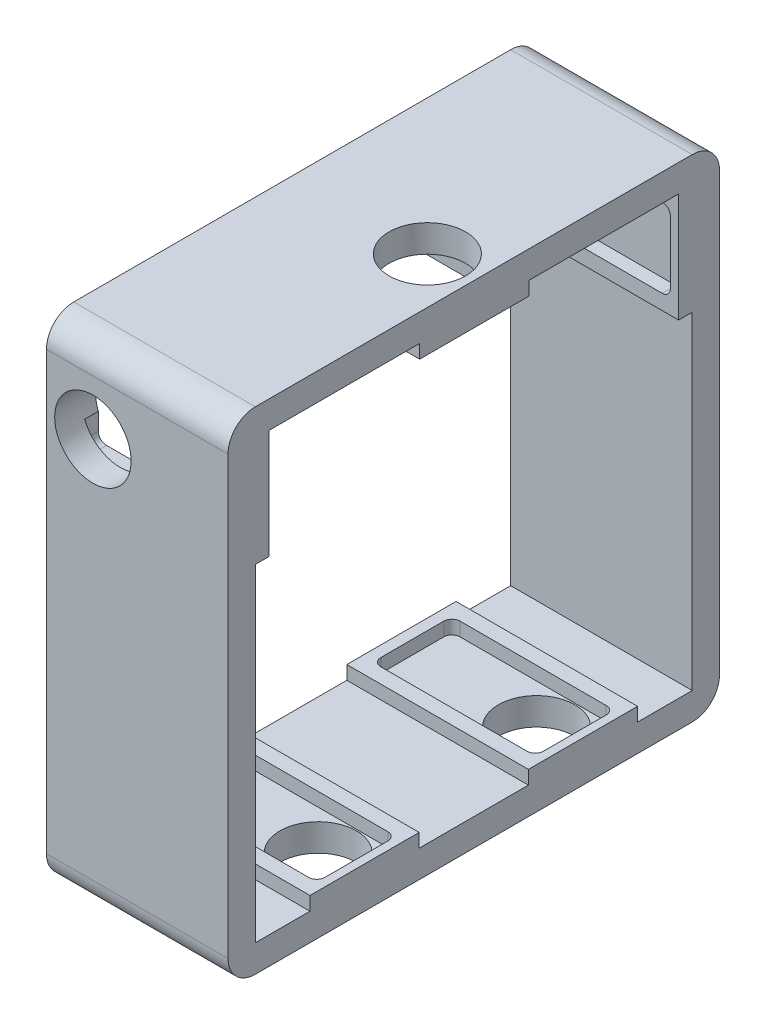
from build123d import *

# Parameters (mm, degrees)
SKETCH1_W           = 66.5
SKETCH1_H           = 180
BOSS_EXTRUDE1_DEPTH = 180
SKETCH3_W           = 160
SKETCH3_H           = 160
CUT_EXTRUDE1_DEPTH  = 180
SKETCH8_W           = 66.5
SKETCH8_H           = 40
BOSS_EXTRUDE2_DEPTH = 5
SKETCH10_W          = 66.5
SKETCH10_H          = 40
BOSS_EXTRUDE3_DEPTH = 5
SKETCH5_R           = 14
CUT_EXTRUDE3_DEPTH  = 10
SKETCH7_R           = 14
CUT_EXTRUDE4_DEPTH  = 10
CUT_EXTRUDE5_DEPTH  = 5
CUT_EXTRUDE6_START  = -5
CUT_EXTRUDE6_DEPTH  = 5
SKETCH12_W          = 66.5
SKETCH12_H          = 40
BOSS_EXTRUDE8_DEPTH = 5
SKETCH15_R          = 14
CUT_EXTRUDE7_DEPTH  = 200
SKETCH16_W          = 66.5
SKETCH16_H          = 40
BOSS_EXTRUDE9_DEPTH = 5
FILLET1_R           = 10
FILLET2_R           = 10


with BuildPart() as part:
    # Sketch1 → Boss-Extrude1 (new body)
    with BuildSketch(Plane.XY):
        with Locations((33.25, 90)):
            Rectangle(SKETCH1_W, SKETCH1_H)
    extrude(amount=BOSS_EXTRUDE1_DEPTH)

    # Sketch3 → Cut-Extrude1 (cut)
    with BuildSketch(Plane.ZY):
        with Locations((90, 90)):
            Rectangle(SKETCH3_W, SKETCH3_H)
    extrude(amount=-CUT_EXTRUDE1_DEPTH, mode=Mode.SUBTRACT)

    # Sketch8 → Boss-Extrude2 (add)
    with BuildSketch(Plane.XY.offset(10)):
        with Locations((33.25, 150)):
            Rectangle(SKETCH8_W, SKETCH8_H)
    extrude(amount=BOSS_EXTRUDE2_DEPTH)

    # Sketch10 → Boss-Extrude3 (add)
    with BuildSketch(Plane(origin=(0, 0, 170), x_dir=(-1, 0, 0), z_dir=(0, 0, -1))):
        with Locations((-33.25, 150)):
            Rectangle(SKETCH10_W, SKETCH10_H)
    extrude(amount=BOSS_EXTRUDE3_DEPTH)

    # Sketch5 → Cut-Extrude3 (cut)
    with BuildSketch(Plane(origin=(0, 180, 0), x_dir=(1, 0, 0), z_dir=(0, 1, 0))):
        with Locations(Location((49.5, -90, 0), (0, 0, 270))):
            Circle(SKETCH5_R)
    extrude(amount=-CUT_EXTRUDE3_DEPTH, mode=Mode.SUBTRACT)

    # Sketch7 → Cut-Extrude4 (cut)
    with BuildSketch(Plane.XZ):
        with Locations(Location((49.5, 50, 0), (0, 0, 270))):
            Circle(SKETCH7_R)
        with Locations(Location((49.5, 130, 0), (0, 0, 270))):
            Circle(SKETCH7_R)
    extrude(amount=-CUT_EXTRUDE4_DEPTH, mode=Mode.SUBTRACT)

    # Sketch9 → Cut-Extrude5 (cut)
    with BuildSketch(Plane.XY.offset(15)):
        with BuildLine():
            Line((60.5, 164.5), (7.5, 164.5))
            ThreePointArc((7.5, 164.5), (5.378679656, 163.621320344), (4.5, 161.5))
            Line((4.5, 161.5), (4.5, 138.5))
            ThreePointArc((4.5, 138.5), (5.378679656, 136.378679656), (7.5, 135.5))
            Line((7.5, 135.5), (60.5, 135.5))
            ThreePointArc((60.5, 135.5), (62.621320344, 136.378679656), (63.5, 138.5))
            Line((63.5, 138.5), (63.5, 161.5))
            ThreePointArc((63.5, 161.5), (62.621320344, 163.621320344), (60.5, 164.5))
        make_face()
    extrude(amount=-CUT_EXTRUDE5_DEPTH, mode=Mode.SUBTRACT)

    # Sketch11 → Cut-Extrude6 (cut)
    with BuildSketch(Plane(origin=(0, 0, 165), x_dir=(-1, 0, 0), z_dir=(0, 0, -1)).offset(CUT_EXTRUDE6_START)):
        with BuildLine():
            Line((-60.5, 164.5), (-7, 164.5))
            ThreePointArc((-7, 164.5), (-4.878679656, 163.621320344), (-4, 161.5))
            Line((-4, 161.5), (-4, 138.5))
            ThreePointArc((-4, 138.5), (-4.878679656, 136.378679656), (-7, 135.5))
            Line((-7, 135.5), (-60.5, 135.5))
            ThreePointArc((-60.5, 135.5), (-62.621320344, 136.378679656), (-63.5, 138.5))
            Line((-63.5, 138.5), (-63.5, 161.5))
            ThreePointArc((-63.5, 161.5), (-62.621320344, 163.621320344), (-60.5, 164.5))
        make_face()
    extrude(amount=CUT_EXTRUDE6_DEPTH, mode=Mode.SUBTRACT)

    # Sketch12 → Boss-Extrude8 (add)
    with BuildSketch(Plane.XZ.offset(-170)):
        with Locations((33.25, 89.833476808)):
            Rectangle(SKETCH12_W, SKETCH12_H)
        with BuildLine():
            Line((60.5, 75.333476808), (7, 75.333476808))
            ThreePointArc((7, 75.333476808), (4.878679656, 76.212156465), (4, 78.333476808))
            Line((4, 78.333476808), (4, 101.333476808))
            ThreePointArc((4, 101.333476808), (4.878679656, 103.454797152), (7, 104.333476808))
            Line((7, 104.333476808), (60.5, 104.333476808))
            ThreePointArc((60.5, 104.333476808), (62.621320344, 103.454797152), (63.5, 101.333476808))
            Line((63.5, 101.333476808), (63.5, 78.333476808))
            ThreePointArc((63.5, 78.333476808), (62.621320344, 76.212156465), (60.5, 75.333476808))
        make_face(mode=Mode.SUBTRACT)
    extrude(amount=BOSS_EXTRUDE8_DEPTH)

    # Sketch15 → Cut-Extrude7 (cut)
    with BuildSketch(Plane(origin=(0, 0, 0), x_dir=(-1, 0, 0), z_dir=(0, 0, -1))):
        with Locations((-17, 150)):
            Circle(SKETCH15_R)
    extrude(amount=-CUT_EXTRUDE7_DEPTH, mode=Mode.SUBTRACT)

    # Sketch16 → Boss-Extrude9 (add)
    # profile 1 of 2: a face of its own
    with BuildSketch(Plane(origin=(0, 10, 0), x_dir=(1, 0, 0), z_dir=(0, 1, 0))):
        with Locations((33.25, -50)):
            Rectangle(SKETCH16_W, SKETCH16_H)
        with BuildLine():
            Line((63.5, -38.5), (63.5, -61.5))
            ThreePointArc((63.5, -61.5), (62.621320344, -63.621320344), (60.5, -64.5))
            Line((60.5, -64.5), (7, -64.5))
            ThreePointArc((7, -64.5), (4.878679656, -63.621320344), (4, -61.5))
            Line((4, -61.5), (4, -38.5))
            ThreePointArc((4, -38.5), (4.878679656, -36.378679656), (7, -35.5))
            Line((7, -35.5), (60.5, -35.5))
            ThreePointArc((60.5, -35.5), (62.621320344, -36.378679656), (63.5, -38.5))
        make_face(mode=Mode.SUBTRACT)
    # profile 2 of 2: a face of its own
    with BuildSketch(Plane(origin=(0, 10, 0), x_dir=(1, 0, 0), z_dir=(0, 1, 0))):
        with Locations((33.25, -130)):
            Rectangle(SKETCH16_W, SKETCH16_H)
        with BuildLine():
            Line((63.5, -141.5), (63.5, -118.5))
            ThreePointArc((63.5, -118.5), (62.621320344, -116.378679656), (60.5, -115.5))
            Line((60.5, -115.5), (7, -115.5))
            ThreePointArc((7, -115.5), (4.878679656, -116.378679656), (4, -118.5))
            Line((4, -118.5), (4, -141.5))
            ThreePointArc((4, -141.5), (4.878679656, -143.621320344), (7, -144.5))
            Line((7, -144.5), (60.5, -144.5))
            ThreePointArc((60.5, -144.5), (62.621320344, -143.621320344), (63.5, -141.5))
        make_face(mode=Mode.SUBTRACT)
    extrude(amount=BOSS_EXTRUDE9_DEPTH)

    # Fillet1
    fillet1_edges = [part.edges().sort_by_distance(p)[0] for p in [
        (33.25, 180, 0),
        (33.25, 0, 0),
    ]]
    fillet(fillet1_edges, radius=FILLET1_R)

    # Fillet2
    fillet2_edges = [part.edges().sort_by_distance(p)[0] for p in [
        (33.25, 180, 180),
        (33.25, 0, 180),
    ]]
    fillet(fillet2_edges, radius=FILLET2_R)


solid = part.part
